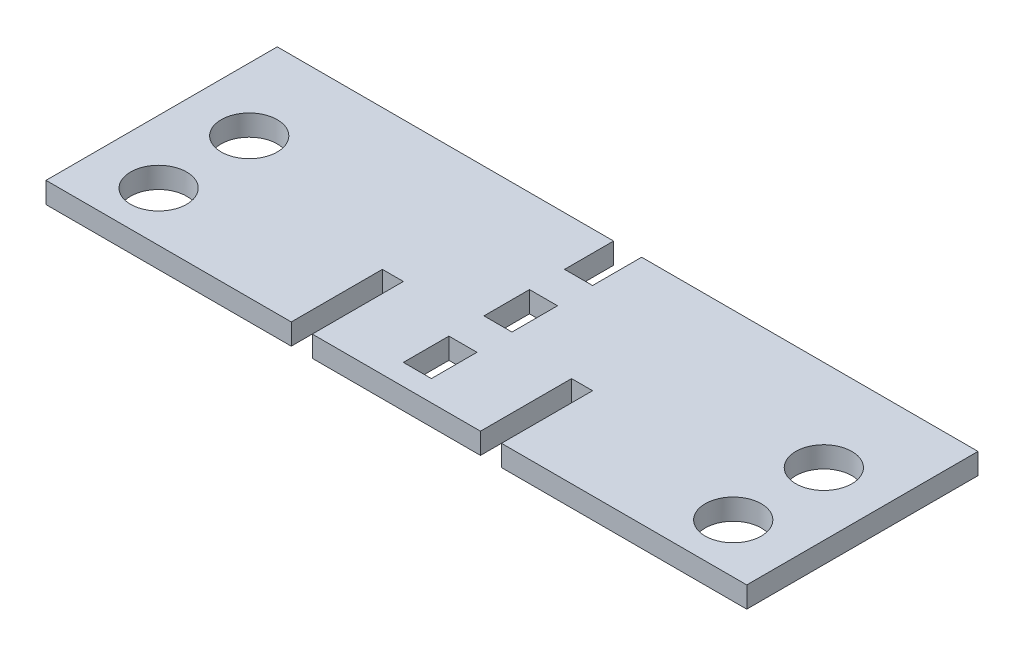
from build123d import *

# Parameters (mm, degrees)
SKETCH_1_R          = 4
EXTRUDE_1_DEPTH     = 3
SKETCH_2_W          = 4
SKETCH_2_H          = 3
CUT_EXTRUDE_1_DEPTH = 3.33
SKETCH_3_W          = 24
SKETCH_3_H          = 13
EXTRUDE_2_DEPTH     = 3
SKETCH_4_W          = 35
SKETCH_4_H          = 13
EXTRUDE_3_DEPTH     = 3
SKETCH_5_R          = 4
CUT_EXTRUDE_2_DEPTH = 25
SKETCH_6_W          = 4
SKETCH_6_H          = 6.5
CUT_EXTRUDE_3_DEPTH = 25


with BuildPart() as part:
    # Эскиз1 → Бобышка-Вытянуть1 (new body)
    with BuildSketch(Plane(origin=(0, 0, 0), x_dir=(1, 0, 0), z_dir=(0, 1, 0))):
        Polygon((2, 10), (50, 10), (50, -10), (-50, -10), (-50, 10), (-2, 10), (-2, 6.32739691), (2, 6.32739691), align=None)
        with Locations(Location((-41, -3, 0), (0, 0, 270))):
            Circle(SKETCH_1_R, mode=Mode.SUBTRACT)
        with Locations(Location((41, -3, 0), (0, 0, 90))):
            Circle(SKETCH_1_R, mode=Mode.SUBTRACT)
    extrude(amount=EXTRUDE_1_DEPTH)

    # Эскиз2 → Вырез-Вытянуть1 (cut)
    with BuildSketch(Plane(origin=(0, 0, -6.32739691), x_dir=(-1, 0, 0), z_dir=(0, 0, -1))):
        with Locations((0, 1.5)):
            Rectangle(SKETCH_2_W, SKETCH_2_H)
    extrude(amount=-CUT_EXTRUDE_1_DEPTH, mode=Mode.SUBTRACT)

    # Эскиз3 → Бобышка-Вытянуть2 (add)
    with BuildSketch(Plane(origin=(0, 3, 0), x_dir=(1, 0, 0), z_dir=(0, 1, 0))):
        with Locations((0, -16.5)):
            Rectangle(SKETCH_3_W, SKETCH_3_H)
    extrude(amount=-EXTRUDE_2_DEPTH)

    # Эскиз4 → Бобышка-Вытянуть3 (add)
    with BuildSketch(Plane(origin=(0, 3, 0), x_dir=(1, 0, 0), z_dir=(0, 1, 0))):
        with Locations((-32.5, -16.5)):
            Rectangle(SKETCH_4_W, SKETCH_4_H)
        with Locations((32.5, -16.5)):
            Rectangle(SKETCH_4_W, SKETCH_4_H)
    extrude(amount=-EXTRUDE_3_DEPTH)

    # Эскиз5 → Вырез-Вытянуть2 (cut)
    with BuildSketch(Plane(origin=(0, 3, 0), x_dir=(1, 0, 0), z_dir=(0, 1, 0))):
        with Locations(Location((-41, -15.92753052, 0), (0, 0, 270))):
            Circle(SKETCH_5_R)
        with Locations(Location((41, -15.92753052, 0), (0, 0, 270))):
            Circle(SKETCH_5_R)
    extrude(amount=-CUT_EXTRUDE_2_DEPTH, mode=Mode.SUBTRACT)

    # Эскиз6 → Вырез-Вытянуть3 (cut)
    with BuildSketch(Plane(origin=(0, 3, 0), x_dir=(1, 0, 0), z_dir=(0, 1, 0))):
        with Locations((0, -5.25260309)):
            Rectangle(SKETCH_6_W, SKETCH_6_H)
        with Locations((0, -16.75260309)):
            Rectangle(SKETCH_6_W, SKETCH_6_H)
    extrude(amount=-CUT_EXTRUDE_3_DEPTH, mode=Mode.SUBTRACT)


solid = part.part
